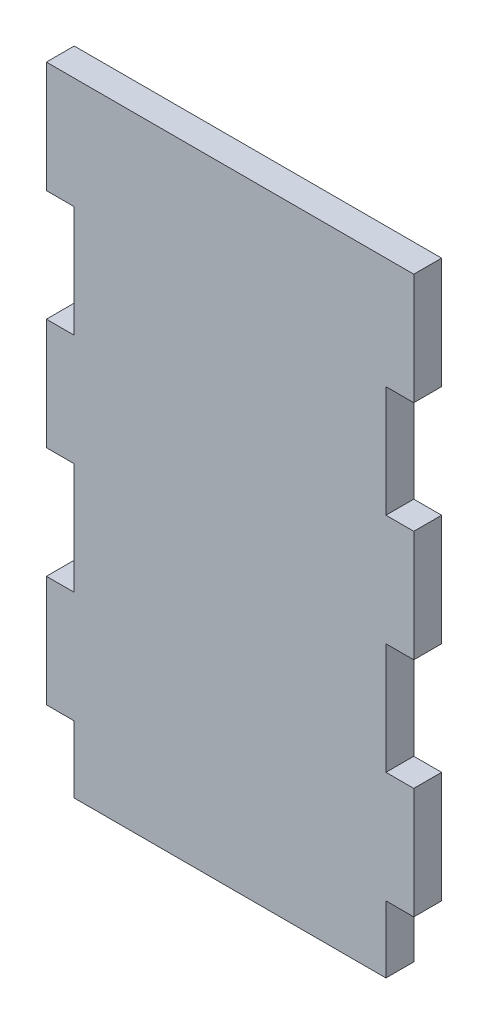
from build123d import *

# Parameters (mm, degrees)
BOSS_EXTRUDE1_DEPTH = 6.35


with BuildPart() as part:
    # Sketch1 → Boss-Extrude1 (new body)
    with BuildSketch(Plane.XY):
        Polygon((-41.91, 45.72), (-35.56, 45.72), (-35.56, 20.32), (-41.91, 20.32), (-41.91, -5.08), (-35.56, -5.08), (-35.56, -30.48), (-41.91, -30.48), (-41.91, -55.88), (-35.56, -55.88), (-35.56, -71.12), (35.56, -71.12), (35.56, -55.88), (41.91, -55.88), (41.91, -30.48), (35.56, -30.48), (35.56, -5.08), (41.91, -5.08), (41.91, 20.32), (35.56, 20.32), (35.56, 45.72), (41.91, 45.72), (41.91, 71.12), (-41.91, 71.12), align=None)
    extrude(amount=BOSS_EXTRUDE1_DEPTH)


solid = part.part
